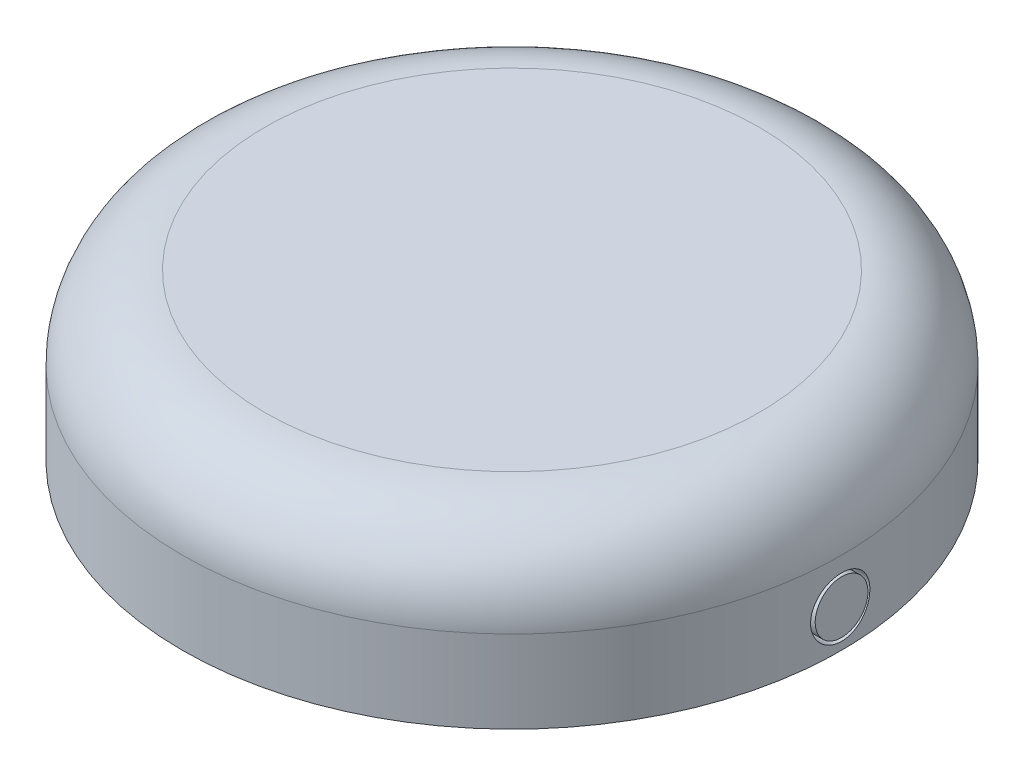
from build123d import *

# Parameters (mm, degrees)
SKETCH_1_R               = 100
EXTRUDE_1_DEPTH          = 50
FILLET_1_R               = 25
SHELL_1_T                = -10
CUT_EXTRUDE_1_DEPTH      = 100
CUT_EXTRUDE_1_DEPTH_BACK = 100
SKETCH_7_R               = 9
SKETCH_8_R               = 8
EXTRUDE_2_DEPTH          = 10
SKETCH_9_W               = 19.636204252
SKETCH_9_H               = 30
EXTRUDE_3_DEPTH          = 3
SKETCH_10_R              = 8
EXTRUDE_4_DEPTH          = 10
SKETCH_11_W              = 19.636204252
SKETCH_11_H              = 25
EXTRUDE_5_DEPTH          = 3


with BuildPart() as part:
    # 草图1 → 凸台-拉伸1 (new body)
    with BuildSketch(Plane(origin=(0, 0, 0), x_dir=(1, 0, 0), z_dir=(0, 1, 0))):
        Circle(SKETCH_1_R)
    extrude(amount=EXTRUDE_1_DEPTH)

    # 圆角1
    fillet_1_edges = [part.edges().sort_by_distance(p)[0] for p in [
        (-100, 50, 0),
    ]]
    fillet(fillet_1_edges, radius=FILLET_1_R)

    # 抽壳1
    shell_1_openings = [part.faces().sort_by_distance(p)[0] for p in [
        (0, 0, 0),
    ]]
    offset(amount=SHELL_1_T, openings=shell_1_openings, kind=Kind.INTERSECTION)

    # 草图7 → 切除-拉伸1 (cut, two sides: drawn at the far end of the back side and taken through both)
    with BuildSketch(Plane(origin=(0, 0, 0), x_dir=(0, 0, -1), z_dir=(1, 0, 0)).offset(-CUT_EXTRUDE_1_DEPTH_BACK)):
        with Locations((0, 11.380292073)):
            Circle(SKETCH_7_R)
    extrude(amount=CUT_EXTRUDE_1_DEPTH + CUT_EXTRUDE_1_DEPTH_BACK, mode=Mode.SUBTRACT)



with BuildPart() as body_2:
    # 草图8 → 凸台-拉伸2 (new body)
    with BuildSketch(Plane(origin=(90, 0, 0), x_dir=(0, 0, -1), z_dir=(1, 0, 0))):
        with Locations((0, 11.380292073)):
            Circle(SKETCH_8_R)
    extrude(amount=EXTRUDE_2_DEPTH)


with BuildPart() as part_1:
    add(part.part)

    add(body_2.part)  # 凸台-拉伸3 merges body 2
    # 草图9 → 凸台-拉伸3 (add)
    with BuildSketch(Plane(origin=(90, 0, 0), x_dir=(0, 0, -1), z_dir=(1, 0, 0))):
        with Locations((0, 16.380292073)):
            Rectangle(SKETCH_9_W, SKETCH_9_H)
    extrude(amount=-EXTRUDE_3_DEPTH)



with BuildPart() as body_2_2:
    # 草图10 → 凸台-拉伸4 (new body)
    with BuildSketch(Plane(origin=(-90, 0, 0), x_dir=(0, 0, -1), z_dir=(1, 0, 0))):
        with Locations((0, 11.380292073)):
            Circle(SKETCH_10_R)
    extrude(amount=-EXTRUDE_4_DEPTH)


with BuildPart() as part_2:
    add(part_1.part)

    add(body_2_2.part)  # 凸台-拉伸5 merges body 2 2
    # 草图11 → 凸台-拉伸5 (add)
    with BuildSketch(Plane(origin=(-90, 0, 0), x_dir=(0, 0, -1), z_dir=(1, 0, 0))):
        with Locations((0, 14.380292073)):
            Rectangle(SKETCH_11_W, SKETCH_11_H)
    extrude(amount=EXTRUDE_5_DEPTH)


solid = part_2.part
